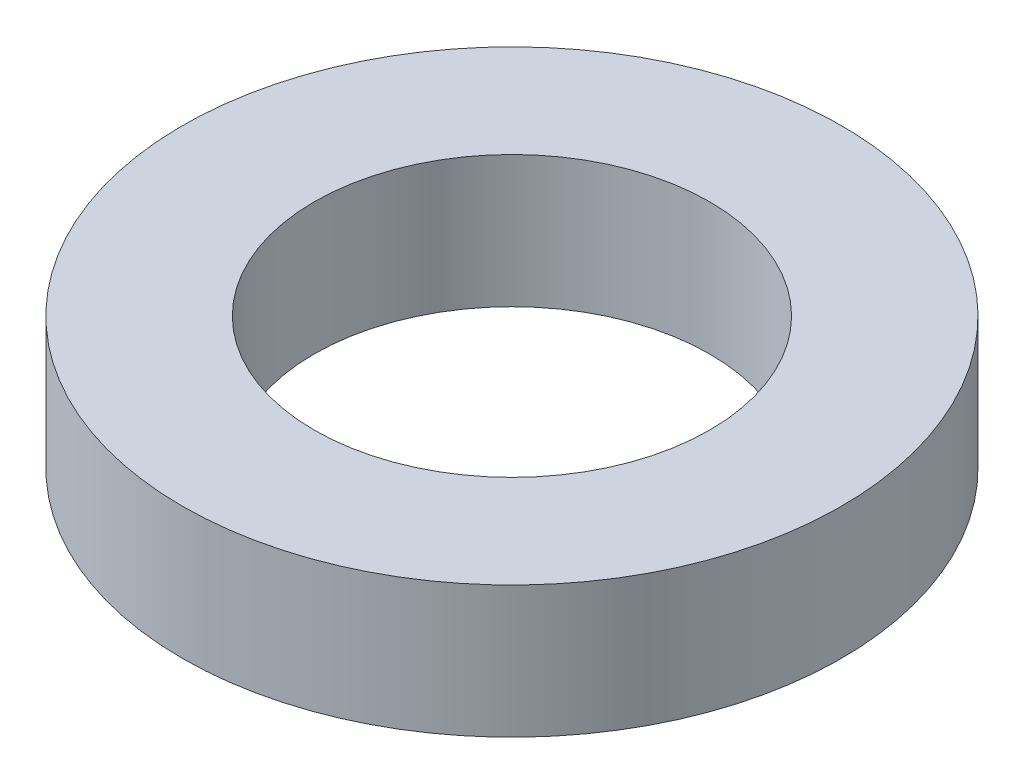
from build123d import *

# Parameters (mm, degrees)
SKETCH_1_R          = 25
EXTRUDE_1_DEPTH     = 10
SKETCH_2_R          = 15
CUT_EXTRUDE_1_DEPTH = 37.742346142


with BuildPart() as part:
    # 草图1 → 凸台-拉伸1 (new body)
    with BuildSketch(Plane(origin=(0, 0, 0), x_dir=(1, 0, 0), z_dir=(0, 1, 0))):
        with Locations(Location((0, 0, 0), (0, 0, 270))):
            Circle(SKETCH_1_R)
    extrude(amount=EXTRUDE_1_DEPTH)

    # 草图2 → 切除-拉伸1 (cut, through all)
    with BuildSketch(Plane(origin=(0, 0, 0), x_dir=(1, 0, 0), z_dir=(0, 1, 0))):
        with Locations(Location((0, 0, 0), (0, 0, 270))):
            Circle(SKETCH_2_R)
    extrude(amount=CUT_EXTRUDE_1_DEPTH, mode=Mode.SUBTRACT)


solid = part.part
